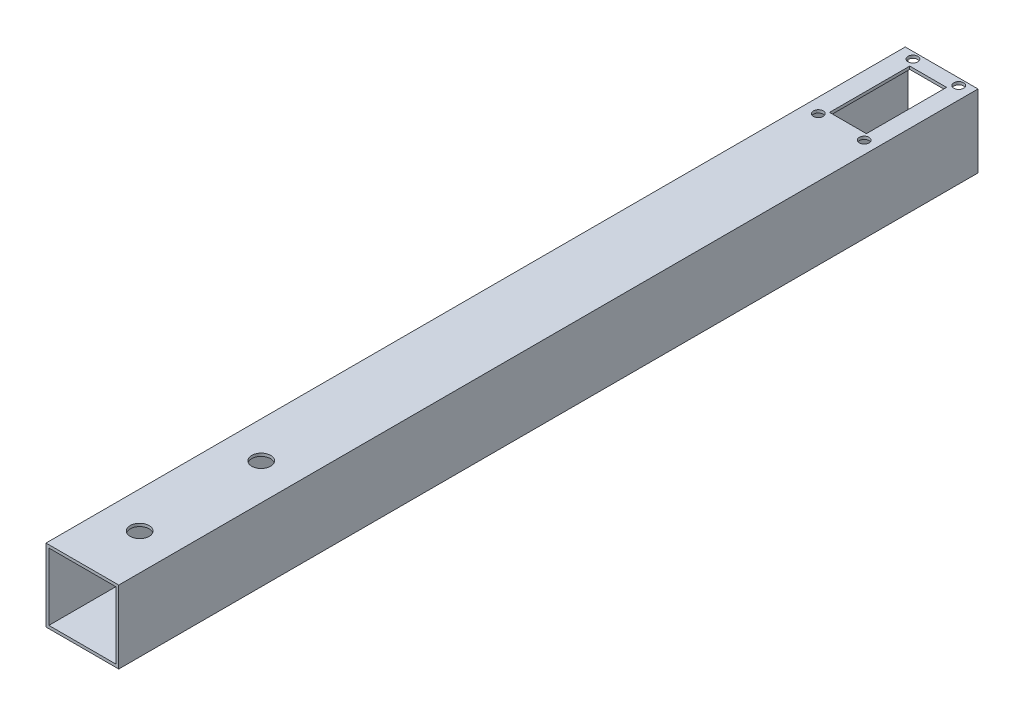
from build123d import *

# Parameters (mm, degrees)
SKETCH1_W                = 25.4
SKETCH1_H                = 25.4
SKETCH1_W_2              = 23.4
SKETCH1_H_2              = 23.4
BOSS_EXTRUDE1_DEPTH      = 300
M6_CLEARANCE_HOLE1_D     = 6.6
M6_CLEARANCE_HOLE1_DEPTH = 10
M6_CLEARANCE_HOLE1_TIP   = 1.982840043
SKETCH5_W                = 12.861112754
SKETCH5_H                = 28
CUT_EXTRUDE2_DEPTH       = 10
M3_CLEARANCE_HOLE1_D     = 3.4
M3_CLEARANCE_HOLE1_DEPTH = 10
M3_CLEARANCE_HOLE1_TIP   = 1.021463052


with BuildPart() as part:
    # Sketch1 → Boss-Extrude1 (new body)
    with BuildSketch(Plane.XY):
        Rectangle(SKETCH1_W, SKETCH1_H)
        Rectangle(SKETCH1_W_2, SKETCH1_H_2, mode=Mode.SUBTRACT)
    extrude(amount=BOSS_EXTRUDE1_DEPTH)

    # M6 Clearance Hole1
    with Locations(Plane(origin=(0, 12.7, 0), x_dir=(1, 0, 0), z_dir=(0, 1, 0))):
        with Locations((0, -280), (0, -237.57)):
            Hole(M6_CLEARANCE_HOLE1_D / 2, depth=M6_CLEARANCE_HOLE1_DEPTH)
            with Locations((0, 0, -(M6_CLEARANCE_HOLE1_DEPTH + M6_CLEARANCE_HOLE1_TIP / 2))):  # 118° drill point
                Cone(0, M6_CLEARANCE_HOLE1_D / 2, M6_CLEARANCE_HOLE1_TIP, mode=Mode.SUBTRACT)

    # Sketch5 → Cut-Extrude2 (cut)
    with BuildSketch(Plane(origin=(0, 12.7, 0), x_dir=(1, 0, 0), z_dir=(0, 1, 0))):
        with Locations((0.3, -19)):
            Rectangle(SKETCH5_W, SKETCH5_H)
    extrude(amount=-CUT_EXTRUDE2_DEPTH, mode=Mode.SUBTRACT)

    # M3 Clearance Hole1
    with Locations(Plane(origin=(0, 12.7, 0), x_dir=(1, 0, 0), z_dir=(0, 1, 0))):
        with Locations((8.3, -2.320031624), (-7.7, -2.320031624), (-7.7, -35.340858472), (8.3, -35.340858472)):
            Hole(M3_CLEARANCE_HOLE1_D / 2, depth=M3_CLEARANCE_HOLE1_DEPTH)
            with Locations((0, 0, -(M3_CLEARANCE_HOLE1_DEPTH + M3_CLEARANCE_HOLE1_TIP / 2))):  # 118° drill point
                Cone(0, M3_CLEARANCE_HOLE1_D / 2, M3_CLEARANCE_HOLE1_TIP, mode=Mode.SUBTRACT)


solid = part.part
